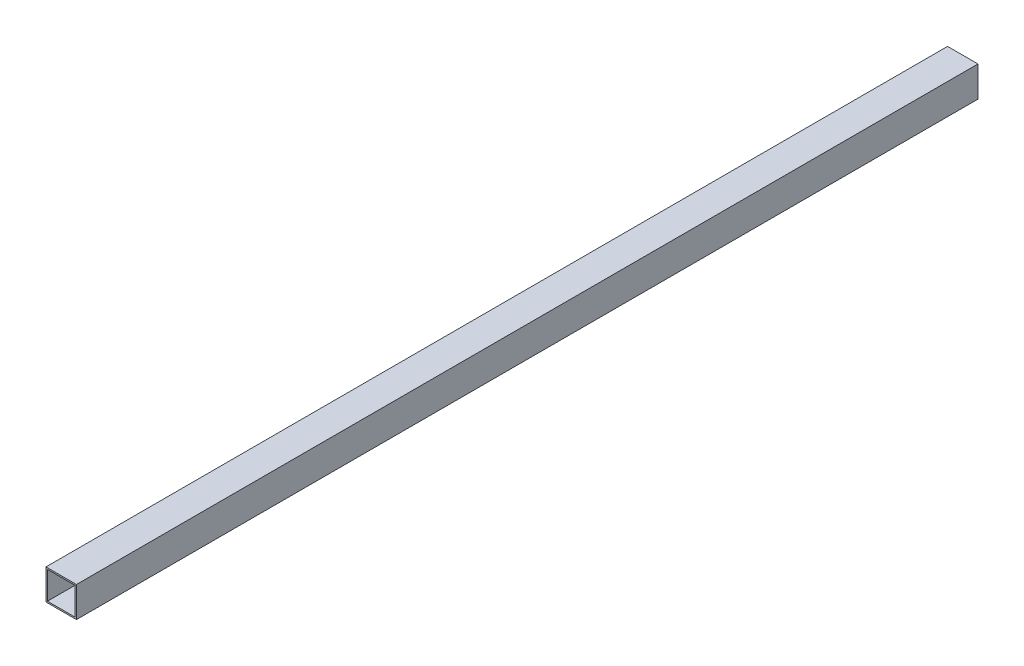
from build123d import *

# Parameters (mm, degrees)
SKETCH1_W           = 25
SKETCH1_H           = 25
SKETCH1_W_2         = 22.6
SKETCH1_H_2         = 22.6
BOSS_EXTRUDE1_DEPTH = 740


with BuildPart() as part:
    # Sketch1 → Boss-Extrude1 (new body)
    with BuildSketch(Plane.XY):
        Rectangle(SKETCH1_W, SKETCH1_H)
        Rectangle(SKETCH1_W_2, SKETCH1_H_2, mode=Mode.SUBTRACT)
    extrude(amount=BOSS_EXTRUDE1_DEPTH)


solid = part.part
